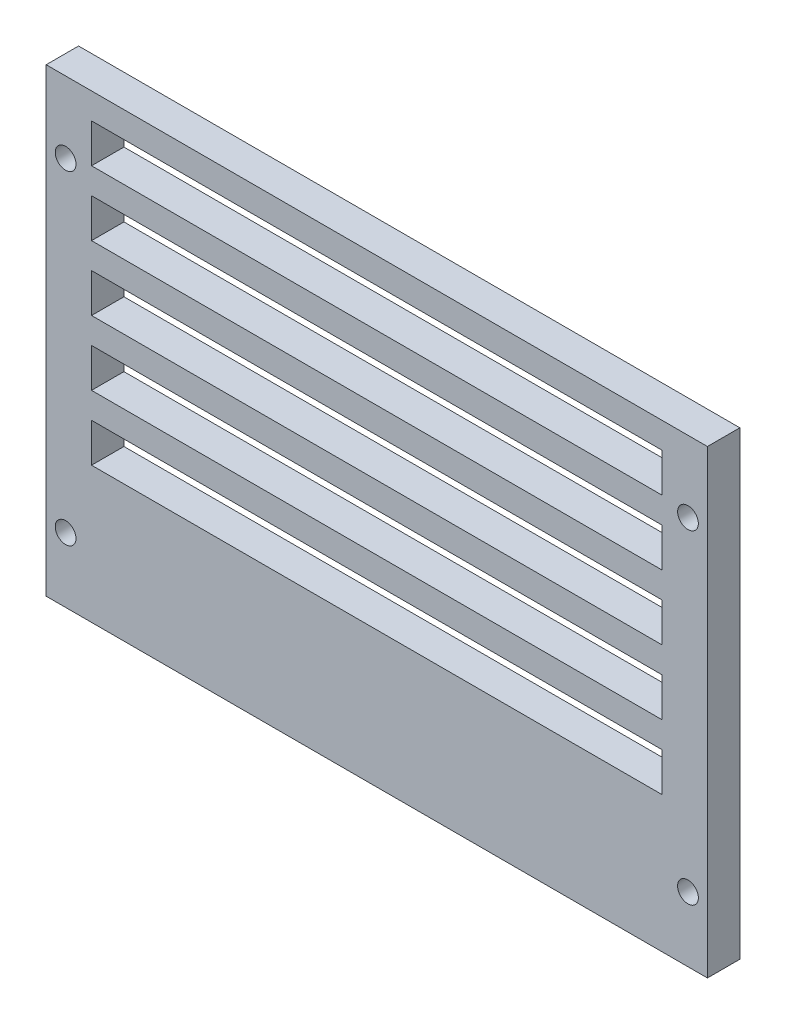
from build123d import *

# Parameters (mm, degrees)
SKETCH_1_W             = 102
SKETCH_1_H             = 65
EXTRUDE_1_DEPTH        = 5
SKETCH_2_R             = 1.6
CUT_EXTRUDE_1_DEPTH    = 122.053707089
SKETCH_3_W             = 102
SKETCH_3_H             = 6
EXTRUDE_2_DEPTH        = 5
SKETCH_4_W             = 88
SKETCH_4_H             = 6
CUT_EXTRUDE_2_DEPTH    = 125.378454726
PATTERN_LINEAR_1_COUNT = 5
PATTERN_LINEAR_1_PITCH = 10


with BuildPart() as part:
    # 草图1 → 凸台-拉伸1 (new body)
    with BuildSketch(Plane.XY):
        with Locations((51, 32.5)):
            Rectangle(SKETCH_1_W, SKETCH_1_H)
    extrude(amount=EXTRUDE_1_DEPTH)

    # 草图2 → 切除-拉伸1 (cut, through all)
    with BuildSketch(Plane.XY.offset(5)):
        with Locations((3, 60)):
            Circle(SKETCH_2_R)
        with Locations((99, 10)):
            Circle(SKETCH_2_R)
        with Locations((3, 10)):
            Circle(SKETCH_2_R)
        with Locations((99, 60)):
            Circle(SKETCH_2_R)
    extrude(amount=-CUT_EXTRUDE_1_DEPTH, mode=Mode.SUBTRACT)

    # 草图3 → 凸台-拉伸2 (add)
    with BuildSketch(Plane.XY.offset(5)):
        with Locations((51, 68)):
            Rectangle(SKETCH_3_W, SKETCH_3_H)
    extrude(amount=-EXTRUDE_2_DEPTH)

    # 草图4 → 切除-拉伸2 (cut, through all)
    with BuildSketch(Plane.XY.offset(5)):
        with Locations((51, 64)):
            Rectangle(SKETCH_4_W, SKETCH_4_H)
    cut_extrude_2 = extrude(amount=-CUT_EXTRUDE_2_DEPTH, mode=Mode.SUBTRACT)

    # 阵列(线性)1: 切除-拉伸2 ×5
    with Locations(*[(0, -i * PATTERN_LINEAR_1_PITCH, 0) for i in range(1, PATTERN_LINEAR_1_COUNT)]):
        add(cut_extrude_2, mode=Mode.SUBTRACT)


solid = part.part
